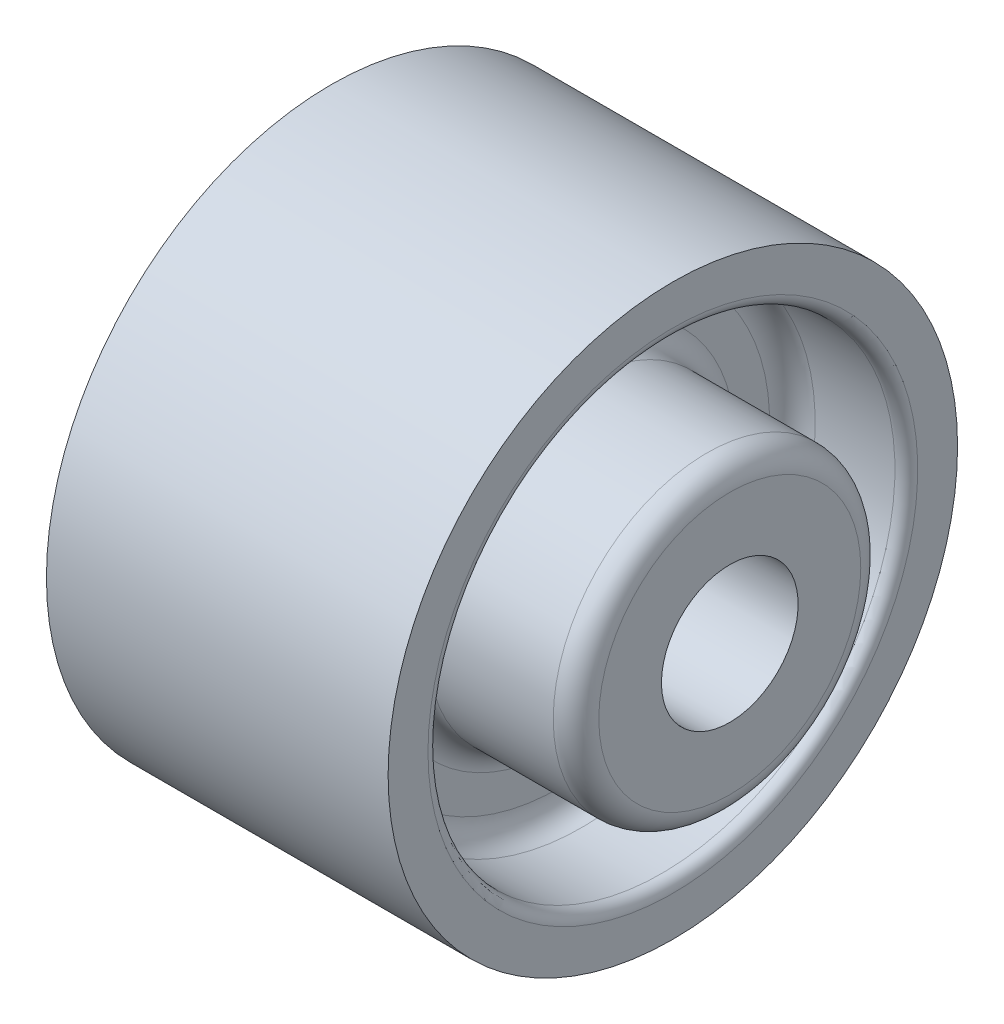
from build123d import *


with BuildPart() as part:
    # Эскиз1 → Повернуть1 (revolve)
    with BuildSketch(Plane.XY, mode=Mode.PRIVATE) as revolve_1_sk:
        with BuildLine():
            Line((-20, 6), (20, 6))
            Line((20, 6), (20, 11.5))
            ThreePointArc((20, 11.5), (19.414213562, 12.914213562), (18, 13.5))
            Line((18, 13.5), (7, 13.5))
            ThreePointArc((7, 13.5), (5.585786438, 14.085786438), (5, 15.5))
            Line((5, 15.5), (5, 18.5))
            ThreePointArc((5, 18.5), (5.585786438, 19.914213562), (7, 20.5))
            Line((7, 20.5), (14, 20.5))
            ThreePointArc((14, 20.5), (14.707106781, 20.792893219), (15, 21.5))
            Line((15, 21.5), (15, 25))
            Line((15, 25), (-15, 25))
            Line((-15, 25), (-15, 21.5))
            ThreePointArc((-15, 21.5), (-14.707106781, 20.792893219), (-14, 20.5))
            Line((-14, 20.5), (-7.382327195, 20.5))
            ThreePointArc((-7.382327195, 20.5), (-5.850551832, 19.78594877), (-5.412542551, 18.153664239))
            Line((-5.412542551, 18.153664239), (-5.940015079, 15.153664239))
            ThreePointArc((-5.940015079, 15.153664239), (-6.623850952, 13.968224637), (-7.909799722, 13.5))
            Line((-7.909799722, 13.5), (-18, 13.5))
            ThreePointArc((-18, 13.5), (-19.414213562, 12.914213562), (-20, 11.5))
            Line((-20, 11.5), (-20, 6))
        make_face()
    revolve(revolve_1_sk.sketch.rotate(Axis((-52.382147487, 0, 0), (1, 0, 0)), 90), axis=Axis((-52.382147487, 0, 0), (1, 0, 0)))


solid = part.part
